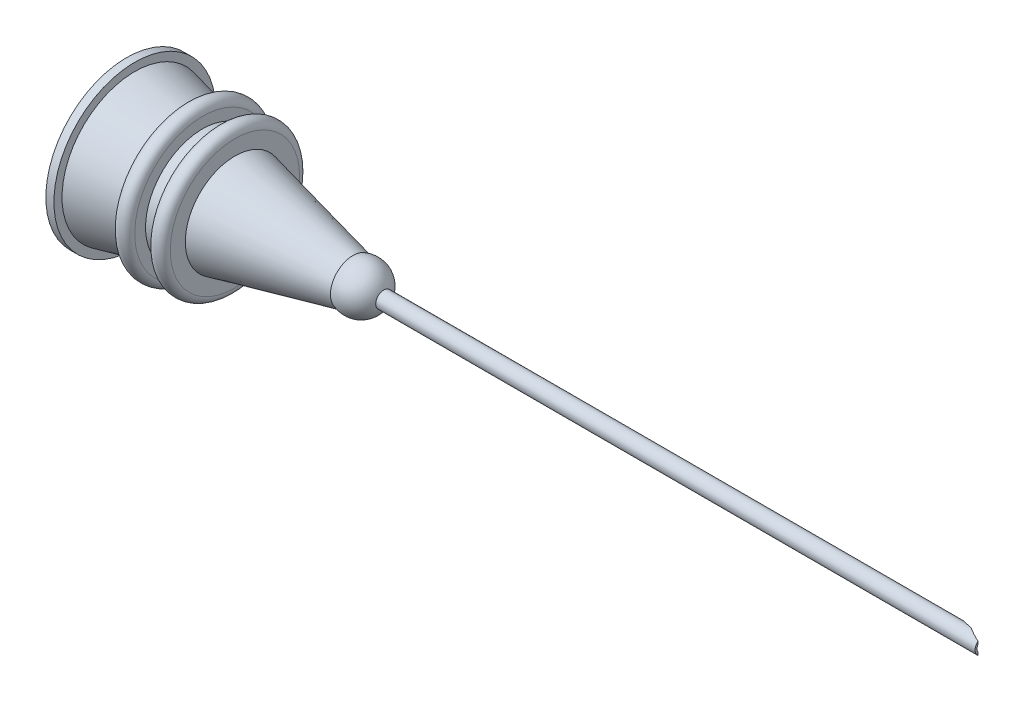
from build123d import *

# Parameters (mm, degrees)
DOME1_FACE_RADIUS       = 1.388792718
DOME1_HEIGHT            = 2
SKETCH4_R               = 0.5
CUT_EXTRUDE1_DEPTH      = 15.798648587
SKETCH5_R               = 0.5
SKETCH5_R_2             = 0.375
EXTRUDE_THIN1_DEPTH     = 40
CUT_EXTRUDE2_DEPTH      = 40.635842365
CUT_EXTRUDE2_DEPTH_BACK = 40.635842365
SKETCH6_R               = 3.5
CUT_EXTRUDE3_DEPTH      = 40.635842464
CUT_EXTRUDE3_DEPTH_BACK = 40.635842464
SKETCH7_R               = 2.807237917


with BuildPart() as part:
    # Sketch2 → Revolve1 (revolve)
    with BuildSketch(Plane.XY, mode=Mode.PRIVATE) as revolve1_sk:
        with BuildLine():
            Line((0, 0), (0, 1.388792718))
            Line((0, 1.388792718), (-7.3, 3.070848066))
            Line((-7.3, 3.070848066), (-7.3, 4))
            ThreePointArc((-7.3, 4), (-7.8, 4.5), (-8.3, 4))
            Line((-8.3, 4), (-8.3, 3.301266606))
            Line((-8.3, 3.301266606), (-9.3, 3.531685147))
            Line((-9.3, 3.531685147), (-9.3, 4.2))
            ThreePointArc((-9.3, 4.2), (-9.8, 4.7), (-10.3, 4.2))
            Line((-10.3, 4.2), (-10.3, 3.762103688))
            Line((-10.3, 3.762103688), (-13.5, 4.499443019))
            Line((-13.5, 4.499443019), (-13.5, 5))
            Line((-13.5, 5), (-14, 5))
            Line((-14, 5), (-14, 3.845))
            Line((-14, 3.845), (-1, 0.849558969))
            Line((-1, 0.849558969), (-1, 0))
            Line((-1, 0), (0, 0))
        make_face()
    revolve(revolve1_sk.sketch.rotate(Axis((-1, 0, 0), (-1, 0, 0)), 90), axis=Axis((-1, 0, 0), (-1, 0, 0)))

    # Dome1: a dome of height H over a round flat face of radius A is a cap of a sphere of radius (A * A + H * H) / (2 * H)
    dome1_r = (DOME1_FACE_RADIUS * DOME1_FACE_RADIUS + DOME1_HEIGHT * DOME1_HEIGHT) / (2 * DOME1_HEIGHT)
    dome1_base = Plane((0, 0, 0), z_dir=(1, 0, 0))
    with Locations(dome1_base.offset(DOME1_HEIGHT - dome1_r)):
        dome1_ball = Sphere(dome1_r, mode=Mode.PRIVATE)
    add(split(dome1_ball, bisect_by=dome1_base, keep=Keep.TOP, mode=Mode.PRIVATE))

    # Sketch4 → Cut-Extrude1 (cut, through all)
    with BuildSketch(Plane.ZY.offset(1)):
        Circle(SKETCH4_R)
    extrude(amount=-CUT_EXTRUDE1_DEPTH, mode=Mode.SUBTRACT)

    # Sketch5 → Extrude-Thin1 (add)
    with BuildSketch(Plane.ZY.offset(1)):
        Circle(SKETCH5_R)
        Circle(SKETCH5_R_2, mode=Mode.SUBTRACT)
    extrude(amount=-EXTRUDE_THIN1_DEPTH)

    # Sketch6 → Cut-Extrude2 (cut, two sides: drawn at the far end of the back side and taken through both)
    with BuildSketch(Plane(origin=(0, 0, 0), x_dir=(1, 0, 0), z_dir=(0, 1, 0)).offset(-CUT_EXTRUDE2_DEPTH_BACK)):
        with Locations((39, 3.471898399)):
            Circle(SKETCH6_R)
    extrude(amount=CUT_EXTRUDE2_DEPTH + CUT_EXTRUDE2_DEPTH_BACK, mode=Mode.SUBTRACT)

    # Sketch7 → Cut-Extrude3 (cut, two sides: drawn at the far end of the back side and taken through both)
    with BuildSketch(Plane(origin=(0, 0, 0), x_dir=(1, 0, 0), z_dir=(0, 1, 0)).offset(-CUT_EXTRUDE3_DEPTH_BACK)):
        with Locations((39.798286637, 2.374228192)):
            Circle(SKETCH7_R)
    extrude(amount=CUT_EXTRUDE3_DEPTH + CUT_EXTRUDE3_DEPTH_BACK, mode=Mode.SUBTRACT)


solid = part.part
